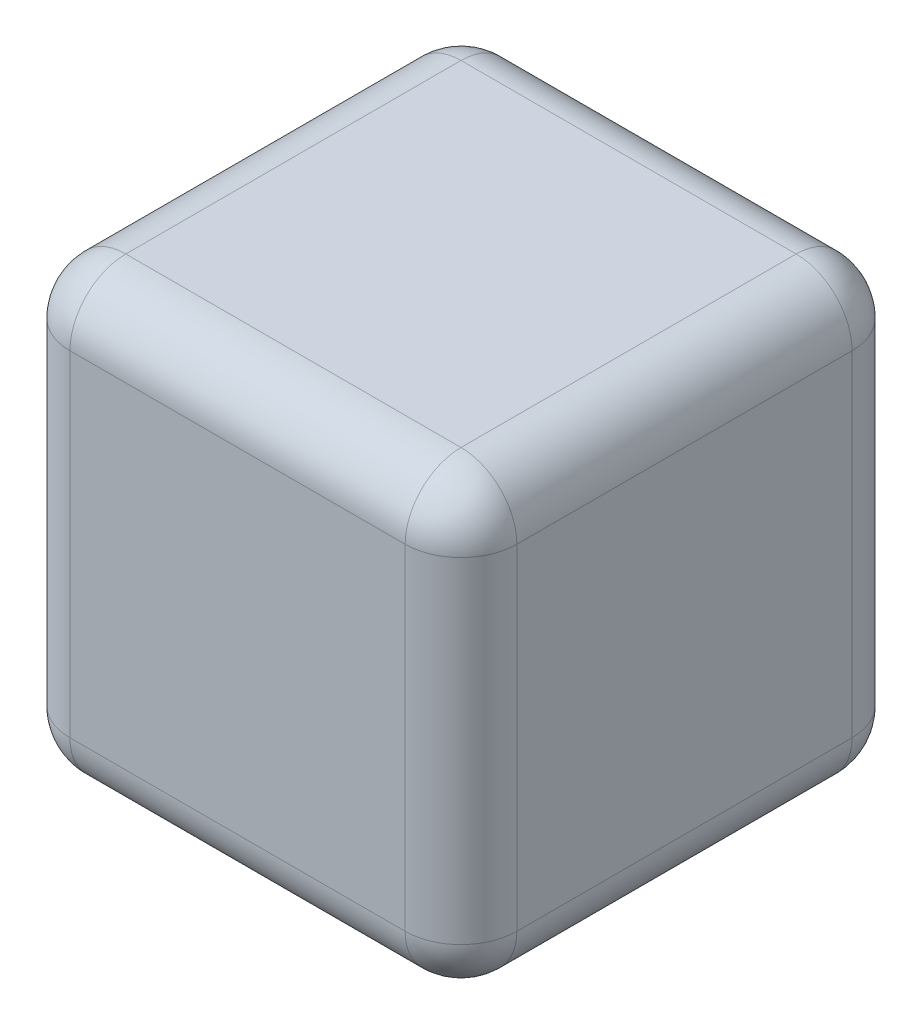
from build123d import *

# Parameters (mm, degrees)
SKETCH1_W           = 80
SKETCH1_H           = 80
BOSS_EXTRUDE1_DEPTH = 80
SKETCH2_R           = 5
BOSS_EXTRUDE2_DEPTH = 20
FILLET1_R           = 10
FILLET2_R           = 2


with BuildPart() as part:
    # Sketch1 → Boss-Extrude1 (new body)
    with BuildSketch(Plane(origin=(0, 0, 0), x_dir=(1, 0, 0), z_dir=(0, 1, 0))):
        Rectangle(SKETCH1_W, SKETCH1_H)
    extrude(amount=BOSS_EXTRUDE1_DEPTH)

    # Sketch2 → Boss-Extrude2 (add)
    with BuildSketch(Plane.XZ):
        with Locations(Location((0, 0, 0), (0, 0, 90))):
            Circle(SKETCH2_R)
    extrude(amount=BOSS_EXTRUDE2_DEPTH)

    # Fillet1
    fillet1_edges = [part.edges().sort_by_distance(p)[0] for p in [
        (-40, 80, 0),
        (0, 80, 40),
        (40, 80, 0),
        (0, 0, 40),
        (-40, 0, 0),
        (0, 0, -40),
        (40, 0, 0),
        (40, 40, 40),
        (-40, 40, 40),
        (-40, 40, -40),
        (40, 40, -40),
        (0, 80, -40),
    ]]
    fillet(fillet1_edges, radius=FILLET1_R)

    # Fillet2
    fillet2_edges = [part.edges().sort_by_distance(p)[0] for p in [
        (0, -20, -5),
    ]]
    fillet(fillet2_edges, radius=FILLET2_R)


solid = part.part
